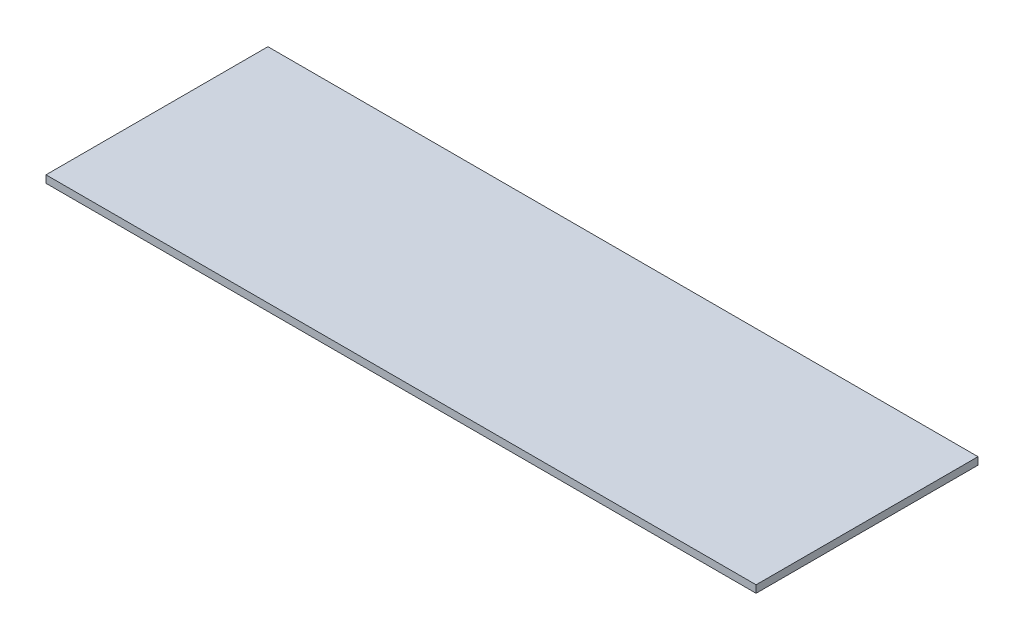
from build123d import *

# Parameters (mm, degrees)
SKETCH2_W           = 266.7
SKETCH2_H           = 76.2
BOSS_EXTRUDE2_DEPTH = 2.54
SKETCH3_W           = 106.044360615
SKETCH3_H           = 67.366643484
CUT_EXTRUDE1_DEPTH  = 19.05
SKETCH4_W           = 100.655249905
SKETCH4_H           = 27.298305346
CUT_EXTRUDE2_DEPTH  = 3.81


with BuildPart() as part:
    # Sketch2 → Boss-Extrude2 (new body)
    with BuildSketch(Plane(origin=(0, 0, 0), x_dir=(1, 0, 0), z_dir=(0, 1, 0))):
        with Locations((133.35, 38.1)):
            Rectangle(SKETCH2_W, SKETCH2_H)
    extrude(amount=BOSS_EXTRUDE2_DEPTH)

    # Sketch3 → Cut-Extrude1 (cut)
    with BuildSketch(Plane.ZY):
        with Locations((-25.444736949, 3.487620746)):
            Rectangle(SKETCH3_W, SKETCH3_H)
    extrude(amount=-CUT_EXTRUDE1_DEPTH, mode=Mode.SUBTRACT)

    # Sketch4 → Cut-Extrude2 (cut)
    with BuildSketch(Plane.ZY.offset(-19.05)):
        with Locations((-42.160911607, -0.947161752)):
            Rectangle(SKETCH4_W, SKETCH4_H)
    extrude(amount=-CUT_EXTRUDE2_DEPTH, mode=Mode.SUBTRACT)


solid = part.part
